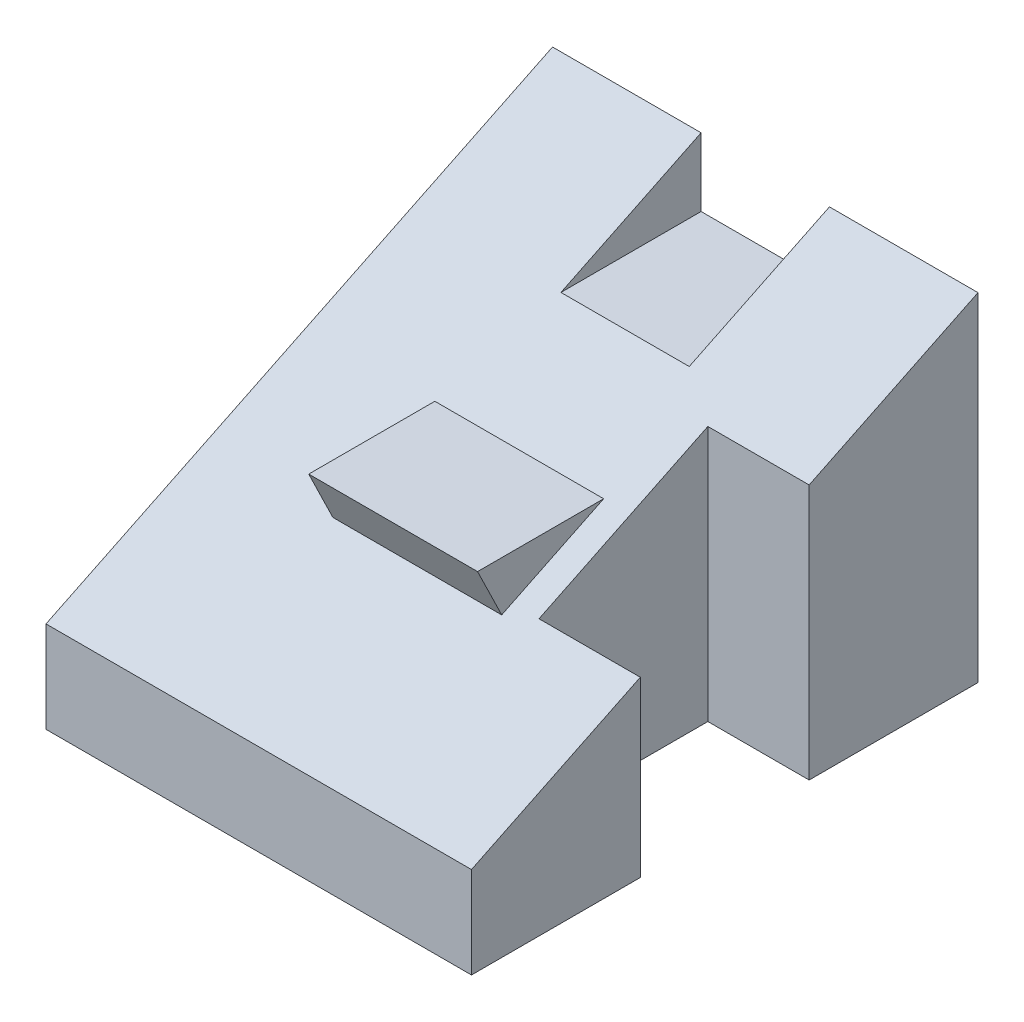
from build123d import *

# Parameters (mm, degrees)
BOSS_EXTRUDE2_DEPTH = 50
CUT_EXTRUDE2_DEPTH  = 63
SKETCH6_W           = 25
SKETCH6_H           = 16.790562981
BOSS_EXTRUDE4_DEPTH = 16
CUT_EXTRUDE8_DEPTH  = 25
SKETCH11_W          = 19
SKETCH11_H          = 10.094840621
CUT_EXTRUDE9_DEPTH  = 25


with BuildPart() as part:
    # Sketch1 → Boss-Extrude2 (new body)
    with BuildSketch(Plane(origin=(0, 0, 0), x_dir=(1, 0, 0), z_dir=(0, 1, 0))):
        Polygon((0, 0), (63, 0), (63, 25), (48, 25), (48, 50), (63, 50), (63, 75), (0, 75), align=None)
    extrude(amount=BOSS_EXTRUDE2_DEPTH)

    # Sketch3 → Cut-Extrude2 (cut)
    with BuildSketch(Plane(origin=(63, 0, 0), x_dir=(0, 0, -1), z_dir=(1, 0, 0))):
        Polygon((75, 50), (0, 13.523152522), (0, 50), align=None)
    extrude(amount=-CUT_EXTRUDE2_DEPTH, mode=Mode.SUBTRACT)

    # Sketch6 → Boss-Extrude4 (add)
    with BuildSketch(Plane(origin=(0, 10.936247914, 5.318931295), x_dir=(1, 0, 0), z_dir=(0, 0.8992805495570562, 0.437372259280763))):
        with Locations((31.5, 40.412961178)):
            Rectangle(SKETCH6_W, SKETCH6_H)
    extrude(amount=BOSS_EXTRUDE4_DEPTH)

    # Sketch10 → Cut-Extrude8 (cut)
    with BuildSketch(Plane(origin=(44, 0, 0), x_dir=(0, 0, -1), z_dir=(1, 0, 0))):
        Polygon((38.573371995, 32.283619282), (19.90226542, 32.283619282), (16.475989141, 39.328381609), (31.575415847, 46.672108075), align=None)
    extrude(amount=-CUT_EXTRUDE8_DEPTH, mode=Mode.SUBTRACT)

    # Sketch11 → Cut-Extrude9 (cut)
    with BuildSketch(Plane(origin=(0, 0, -75), x_dir=(-1, 0, 0), z_dir=(0, 0, -1))):
        with Locations((-31.5, 44.952579689)):
            Rectangle(SKETCH11_W, SKETCH11_H)
    extrude(amount=-CUT_EXTRUDE9_DEPTH, mode=Mode.SUBTRACT)


solid = part.part
